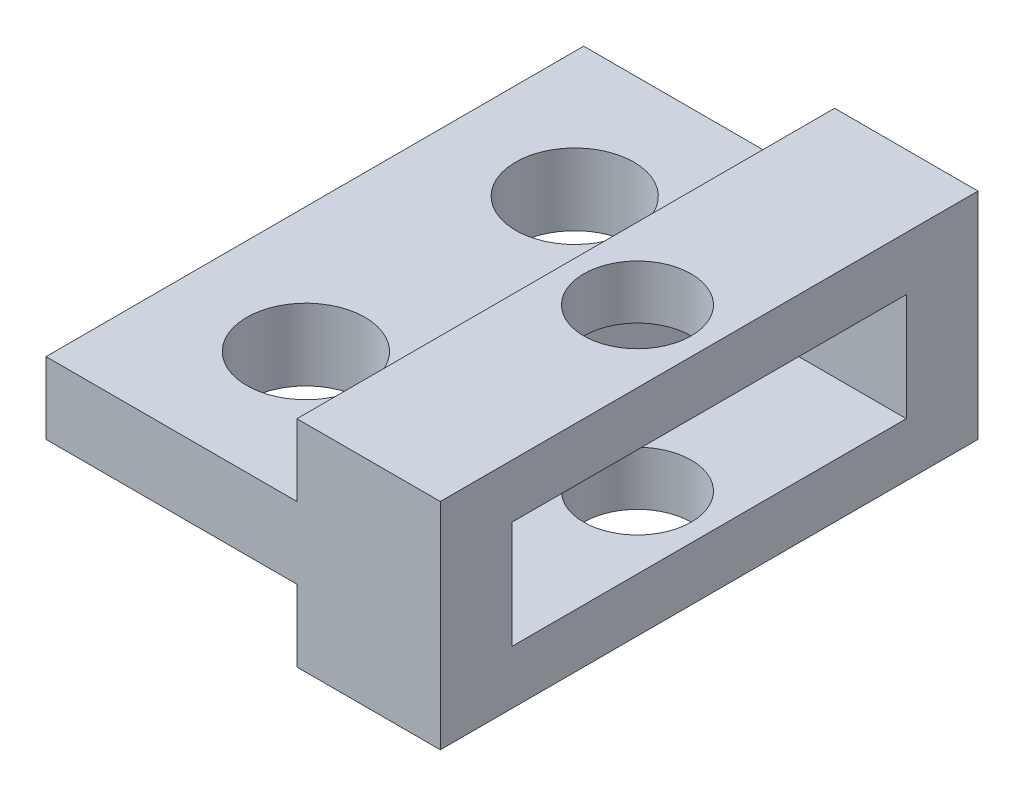
from build123d import *

# Parameters (mm, degrees)
SKETCH1_W           = 11
SKETCH1_H           = 15
BOSS_EXTRUDE3_DEPTH = 2
SKETCH2_W           = 4
SKETCH2_H           = 15
BOSS_EXTRUDE4_DEPTH = 2
SKETCH3_W           = 4
SKETCH3_H           = 15
BOSS_EXTRUDE5_DEPTH = 2
SKETCH4_R           = 1.65
CUT_EXTRUDE2_DEPTH  = 13
SKETCH6_W           = 11
SKETCH6_H           = 3
CUT_EXTRUDE4_DEPTH  = 3.8
SKETCH7_R           = 1.5
CUT_EXTRUDE5_DEPTH  = 17.8


with BuildPart() as part:
    # Sketch1 → Boss-Extrude3 (new body)
    with BuildSketch(Plane(origin=(0, 0, 0), x_dir=(1, 0, 0), z_dir=(0, 1, 0))):
        with Locations((-5.5, 7.5)):
            Rectangle(SKETCH1_W, SKETCH1_H)
    extrude(amount=BOSS_EXTRUDE3_DEPTH)

    # Sketch2 → Boss-Extrude4 (add)
    with BuildSketch(Plane(origin=(0, 2, 0), x_dir=(1, 0, 0), z_dir=(0, 1, 0))):
        with Locations((-2, 7.5)):
            Rectangle(SKETCH2_W, SKETCH2_H)
    extrude(amount=BOSS_EXTRUDE4_DEPTH)

    # Sketch3 → Boss-Extrude5 (add)
    with BuildSketch(Plane(origin=(0, 0, 0), x_dir=(-1, 0, 0), z_dir=(0, -1, 0))):
        with Locations((2, 7.5)):
            Rectangle(SKETCH3_W, SKETCH3_H)
    extrude(amount=BOSS_EXTRUDE5_DEPTH)

    # Sketch4 → Cut-Extrude2 (cut)
    with BuildSketch(Plane(origin=(0, 0, 0), x_dir=(-1, 0, 0), z_dir=(0, -1, 0))):
        with Locations(Location((7.5, 11.25, 0), (0, 0, 90))):
            Circle(SKETCH4_R)
        with Locations(Location((7.5, 3.75, 0), (0, 0, 90))):
            Circle(SKETCH4_R)
    extrude(amount=-CUT_EXTRUDE2_DEPTH, mode=Mode.SUBTRACT)

    # Sketch6 → Cut-Extrude4 (cut)
    with BuildSketch(Plane(origin=(0, 0, 0), x_dir=(0, 0, -1), z_dir=(1, 0, 0))):
        with Locations((7.5, 1)):
            Rectangle(SKETCH6_W, SKETCH6_H)
    extrude(amount=-CUT_EXTRUDE4_DEPTH, mode=Mode.SUBTRACT)

    # Sketch7 → Cut-Extrude5 (cut)
    with BuildSketch(Plane(origin=(0, -2, 0), x_dir=(-1, 0, 0), z_dir=(0, -1, 0))):
        with Locations(Location((2, 7.5, 0), (0, 0, 90))):
            Circle(SKETCH7_R)
    extrude(amount=-CUT_EXTRUDE5_DEPTH, mode=Mode.SUBTRACT)


solid = part.part
